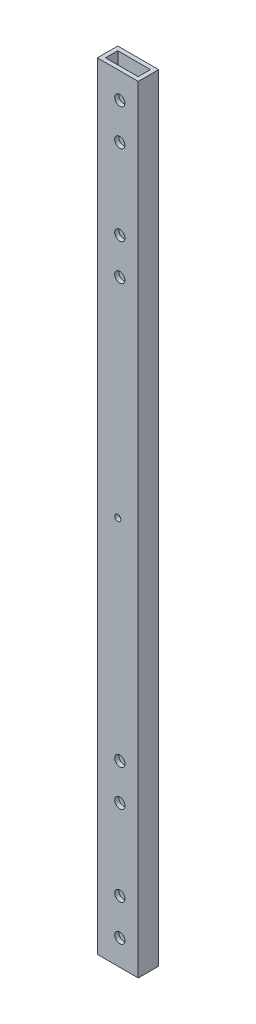
from build123d import *

# Parameters (mm, degrees)
SKETCH_1_W          = 20
SKETCH_1_H          = 10
SKETCH_1_W_2        = 16
SKETCH_1_H_2        = 6
EXTRUDE_1_DEPTH     = 190
SKETCH_2_R          = 2.5
CUT_EXTRUDE_1_DEPTH = 191.525588833
SKETCH_3_R          = 1.5
CUT_EXTRUDE_2_DEPTH = 191.525588833


with BuildPart() as part:
    # 草图1 → 凸台-拉伸1 (new, symmetric)
    with BuildSketch(Plane(origin=(0, 0, 0), x_dir=(1, 0, 0), z_dir=(0, 1, 0))):
        Rectangle(SKETCH_1_W, SKETCH_1_H)
        Rectangle(SKETCH_1_W_2, SKETCH_1_H_2, mode=Mode.SUBTRACT)
    extrude(amount=EXTRUDE_1_DEPTH, both=True)

    # 草图2 → 切除-拉伸1 (cut, through all)
    with BuildSketch(Plane.XY.offset(5)):
        with Locations((1, -177.5)):
            Circle(SKETCH_2_R)
        with Locations((1, -159.7)):
            Circle(SKETCH_2_R)
        with Locations((1, -120.3)):
            Circle(SKETCH_2_R)
        with Locations((1, -102.5)):
            Circle(SKETCH_2_R)
        with Locations(Location((1, 102.5, 0), (0, 0, 180))):
            Circle(SKETCH_2_R)
        with Locations(Location((1, 120.3, 0), (0, 0, 180))):
            Circle(SKETCH_2_R)
        with Locations(Location((1, 159.7, 0), (0, 0, 180))):
            Circle(SKETCH_2_R)
        with Locations(Location((1, 177.5, 0), (0, 0, 180))):
            Circle(SKETCH_2_R)
    extrude(amount=-CUT_EXTRUDE_1_DEPTH, mode=Mode.SUBTRACT)

    # 草图3 → 切除-拉伸2 (cut, through all)
    with BuildSketch(Plane(origin=(0, 0, -5), x_dir=(-1, 0, 0), z_dir=(0, 0, -1))):
        Circle(SKETCH_3_R)
    extrude(amount=-CUT_EXTRUDE_2_DEPTH, mode=Mode.SUBTRACT)


solid = part.part
